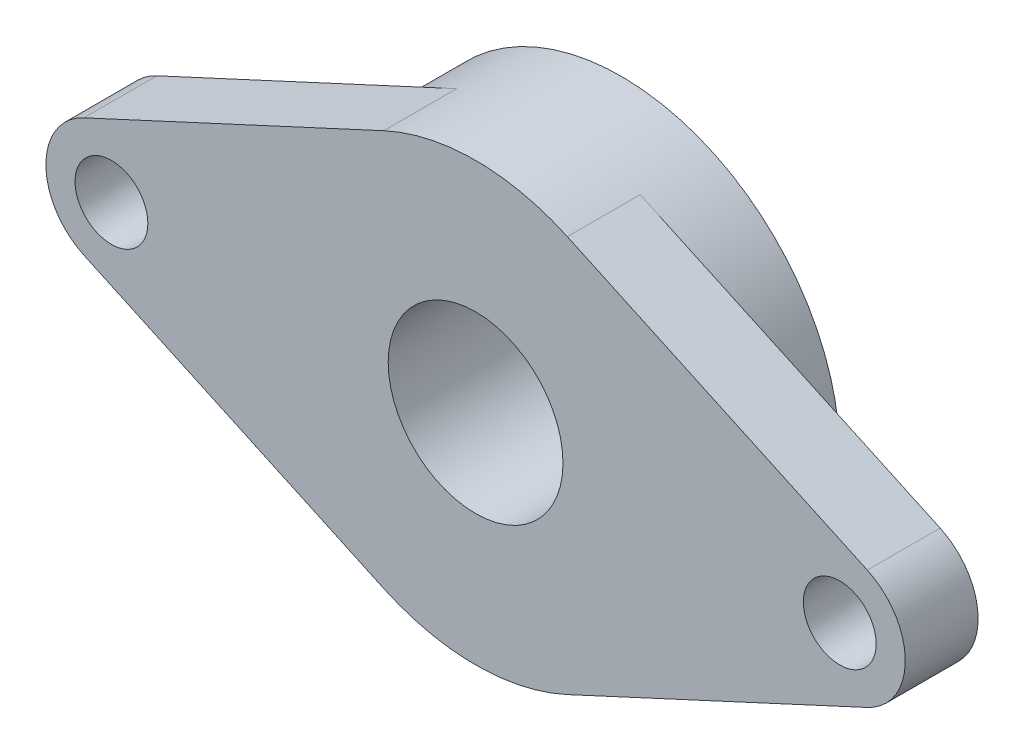
from build123d import *

# Parameters (mm, degrees)
SKETCH1_R           = 2.5
SKETCH1_R_2         = 6
BOSS_EXTRUDE1_DEPTH = 5
BOSS_EXTRUDE2_START = 5
SKETCH2_R           = 15
SKETCH2_R_2         = 6
BOSS_EXTRUDE2_DEPTH = 5


with BuildPart() as part:
    # Sketch1 → Boss-Extrude1 (new body)
    with BuildSketch(Plane.XY):
        with BuildLine():
            Line((6.3, -13.612861565), (26.89, -4.08385847))
            ThreePointArc((26.89, -4.08385847), (29.5, 0), (26.89, 4.08385847))
            Line((26.89, 4.08385847), (6.3, 13.612861565))
            ThreePointArc((6.3, 13.612861565), (0, 15), (-6.3, 13.612861565))
            Line((-6.3, 13.612861565), (-26.89, 4.08385847))
            ThreePointArc((-26.89, 4.08385847), (-29.5, 0), (-26.89, -4.08385847))
            Line((-26.89, -4.08385847), (-6.3, -13.612861565))
            ThreePointArc((-6.3, -13.612861565), (0, -15), (6.3, -13.612861565))
        make_face()
        with Locations((25, 0)):
            Circle(SKETCH1_R, mode=Mode.SUBTRACT)
        Circle(SKETCH1_R_2, mode=Mode.SUBTRACT)
        with Locations((-25, 0)):
            Circle(SKETCH1_R, mode=Mode.SUBTRACT)
    extrude(amount=BOSS_EXTRUDE1_DEPTH)

    # Sketch2 → Boss-Extrude2 (add)
    with BuildSketch(Plane(origin=(0, 0, 0), x_dir=(-1, 0, 0), z_dir=(0, 0, -1)).offset(BOSS_EXTRUDE2_START)):
        Circle(SKETCH2_R)
        Circle(SKETCH2_R_2, mode=Mode.SUBTRACT)
    extrude(amount=-BOSS_EXTRUDE2_DEPTH)


solid = part.part
